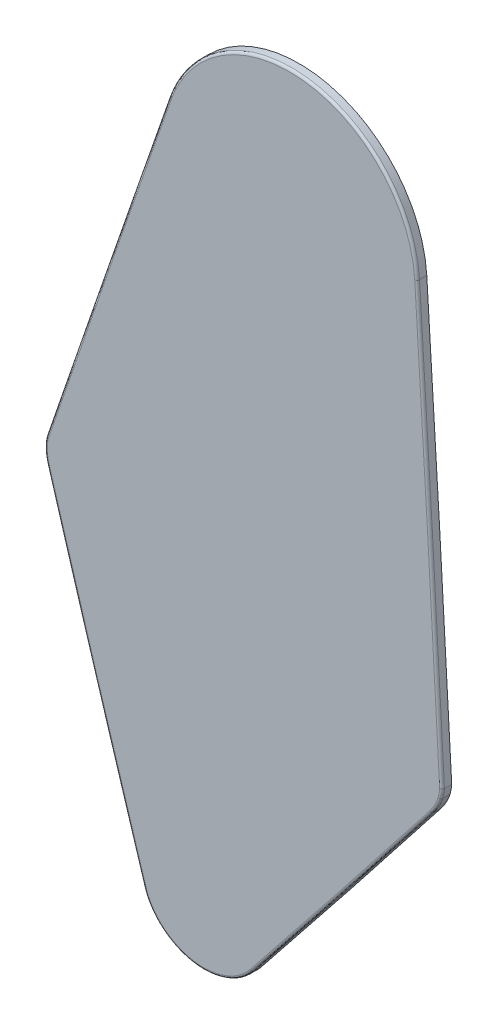
from build123d import *

# Parameters (mm, degrees)
BOSS_EXTRUDE1_DEPTH = 2
FILLET1_R           = 0.5


with BuildPart() as part:
    # Sketch1 → Boss-Extrude1 (new body)
    with BuildSketch(Plane(origin=(0, 0, 4), x_dir=(0, -1, 0), z_dir=(0, 0, 1))):
        with BuildLine():
            add(Edge.make_bspline(
                [(139.450972675, -7.813227213), (139.9020681, -8.174633534), (140.317686962, -8.56749353), (141.089365118, -9.406019292), (141.44499316, -9.852067408), (141.934013527, -10.56052405), (142.090082433, -10.804075882), (142.383783218, -11.298182044), (142.52174943, -11.549104648), (142.909766242, -12.313145336), (143.134011755, -12.837502876), (143.513737735, -13.916168705), (143.670115697, -14.474198308), (143.907792027, -15.595135117), (143.989990246, -16.159060802), (144.081596024, -17.29378057), (144.091210483, -17.86455513), (144.050732187, -18.725897235), (144.027944708, -19.014016492), (143.964517531, -19.583858278), (143.842526715, -20.432107535), (143.640476487, -21.260935573), (143.386001237, -22.077046081), (143.292400155, -22.346953991), (143.08727551, -22.882422084), (142.975287609, -23.148929859), (142.376052897, -24.454563867), (141.772241726, -25.418037639), (140.681419583, -26.742694404), (140.283649601, -27.165170815), (139.446417831, -27.942114228), (139.004918976, -28.300079971), (138.075048596, -28.953524114), (137.586559902, -29.248846314), (136.556705751, -29.768999136), (136.02346236, -29.990736228), (135.471560528, -30.162790036)],
                knots=[0, 0, 0, 0, 0.0625, 0.0625, 0.125, 0.125, 0.15625, 0.15625, 0.1875, 0.1875, 0.25, 0.25, 0.3125, 0.3125, 0.375, 0.375, 0.4375, 0.4375, 0.46875, 0.46875, 0.5, 0.5625, 0.5625, 0.59375, 0.59375, 0.625, 0.625, 0.75, 0.75, 0.8125, 0.8125, 0.875, 0.875, 0.9375, 0.9375, 1, 1, 1, 1], degree=3))
            add(Edge.make_bspline(
                [(135.471560528, -30.162790036), (124.49225901, -33.585555675), (113.507299663, -36.990015295), (91.510234262, -43.711100533), (80.498093697, -47.026952318), (69.47206923, -50.296167545)],
                knots=[0, 0, 0, 0, 0.5, 0.5, 1, 1, 1, 1], degree=3))
            add(Edge.make_bspline(
                [(69.47206923, -50.296167545), (69.050895619, -50.421045481), (68.624535331, -50.521504753), (67.761036745, -50.671680868), (67.323505427, -50.721035605), (66.448797899, -50.761154085), (66.007695709, -50.75225952), (65.355143212, -50.685388445), (65.139130371, -50.654247917), (64.710908453, -50.569593708), (64.49852294, -50.517117791), (64.289362518, -50.445672383)],
                knots=[0, 0, 0, 0, 0.25, 0.25, 0.5, 0.5, 0.75, 0.75, 0.875, 0.875, 1, 1, 1, 1], degree=3))
            add(Edge.make_bspline(
                [(64.289362518, -50.445672383), (52.055889155, -46.266939683), (39.830762911, -42.063832175), (15.397996369, -33.607012179), (3.190662652, -29.352485868), (-9.011629986, -25.083565565)],
                knots=[0, 0, 0, 0, 0.5, 0.5, 1, 1, 1, 1], degree=3))
            add(Edge.make_bspline(
                [(-9.011629986, -25.083565565), (-10.457097623, -24.577874845), (-11.837596124, -23.954767096), (-13.816281658, -22.85372382), (-14.460357854, -22.458722586), (-15.71692854, -21.61164332), (-16.33037051, -21.158732873), (-18.115064682, -19.715490012), (-19.205164553, -18.664446434), (-20.69889889, -16.961805671), (-21.173019683, -16.373048795), (-22.072614854, -15.152165557), (-22.499281544, -14.517935796), (-23.694365629, -12.56088214), (-24.367999307, -11.205432831), (-25.202466715, -9.099704953), (-25.451082013, -8.385616768), (-25.778981974, -7.295922517), (-25.880762616, -6.929591041), (-26.068973339, -6.190599395), (-26.155567717, -5.81702664), (-26.546144916, -3.948082598), (-26.726497605, -2.445815181), (-26.806036818, -0.182131986), (-26.80046739, 0.574156262), (-26.743460499, 1.71120789), (-26.716332105, 2.090662573), (-26.645516992, 2.850463368), (-26.601702483, 3.231525693), (-26.342756361, 5.121734807), (-26.008729858, 6.59692218), (-25.324267668, 8.756239315), (-25.065197012, 9.467000133), (-24.629665728, 10.519463587), (-24.476654205, 10.868001161), (-24.154667394, 11.560423194), (-23.985505984, 11.904570012), (-23.10768424, 13.5969141), (-22.297613304, 14.873611374), (-20.927495293, 16.677692697), (-20.444710153, 17.260384468), (-19.426022451, 18.387744063), (-18.887298966, 18.934916671), (-17.214116849, 20.492490541), (-16.022054892, 21.421580775), (-14.124471512, 22.659010632), (-13.47358936, 23.045301846), (-12.134363657, 23.764439644), (-11.442693512, 24.098550084), (-9.344792113, 25.001510328), (-7.910232301, 25.475191114), (-5.706696813, 26.00127411), (-4.963519583, 26.145719023), (-3.459454956, 26.3714232), (-2.696834028, 26.452679775), (-1.932857898, 26.500267131)],
                knots=[0, 0, 0, 0, 0.0625, 0.0625, 0.09375, 0.09375, 0.125, 0.125, 0.1875, 0.1875, 0.21875, 0.21875, 0.25, 0.25, 0.3125, 0.3125, 0.34375, 0.34375, 0.359375, 0.359375, 0.375, 0.375, 0.4375, 0.4375, 0.46875, 0.46875, 0.484375, 0.484375, 0.5, 0.5, 0.5625, 0.5625, 0.59375, 0.59375, 0.609375, 0.609375, 0.625, 0.625, 0.6875, 0.6875, 0.71875, 0.71875, 0.75, 0.75, 0.8125, 0.8125, 0.84375, 0.84375, 0.875, 0.875, 0.9375, 0.9375, 0.96875, 0.96875, 1, 1, 1, 1], degree=3))
            add(Edge.make_bspline(
                [(-1.932857898, 26.500267131), (12.872551581, 27.422482184), (27.679249596, 28.32401709), (57.297186628, 30.050197898), (72.108224175, 30.877661041), (86.921069661, 31.671659922)],
                knots=[0, 0, 0, 0, 0.5, 0.5, 1, 1, 1, 1], degree=3))
            add(Edge.make_bspline(
                [(86.921069661, 31.671659922), (86.962144299, 31.672670802), (87.003101163, 31.669270312), (87.084927334, 31.663359466), (87.125776746, 31.659726494), (87.248204398, 31.647544457), (87.329703078, 31.637689492), (87.573290464, 31.604284048), (87.734639028, 31.576919978), (88.055017152, 31.510866646), (88.213633886, 31.470161288), (88.410650939, 31.413156155), (88.450422431, 31.403552708), (88.531161306, 31.390186124), (88.572180825, 31.387093244), (88.694824689, 31.37557652), (88.774704364, 31.357314169), (88.853406791, 31.332434039)],
                knots=[0, 0, 0, 0, 0.0625, 0.0625, 0.125, 0.125, 0.25, 0.25, 0.5, 0.5, 0.75, 0.75, 0.8125, 0.8125, 0.875, 0.875, 1, 1, 1, 1], degree=3))
            add(Edge.make_bspline(
                [(88.853406791, 31.332434039), (89.476527228, 31.135872184), (90.077320208, 30.875312949), (91.224995144, 30.255859313), (91.772004327, 29.896494909), (92.287268545, 29.495079103)],
                knots=[0, 0, 0, 0, 0.5, 0.5, 1, 1, 1, 1], degree=3))
            add(Edge.make_bspline(
                [(92.287268545, 29.495079103), (100.19387841, 23.335446697), (108.077118274, 17.145864821), (123.794520332, 4.704634127), (131.629012809, -1.54646949), (139.450972675, -7.813227213)],
                knots=[0, 0, 0, 0, 0.5, 0.5, 1, 1, 1, 1], degree=3))
        make_face()
    extrude(amount=-BOSS_EXTRUDE1_DEPTH)

    # Fillet1
    fillet1_edges = [part.edges().sort_by_distance(p)[0] for p in [
        (-20.141456087, -143.875308021, 4),
        (-40.350570151, -102.508726912, 4),
        (-50.741032132, -66.887516927, 4),
        (-37.83542014, -27.614373754, 4),
        (3.606934675, 26.550273804, 4),
        (29.187107866, -42.48822449, 4),
        (31.54389449, -87.894822376, 4),
        (30.565566472, -90.651194098, 4),
        (10.925257021, -115.935809769, 4),
    ]]
    fillet(fillet1_edges, radius=FILLET1_R)


solid = part.part
